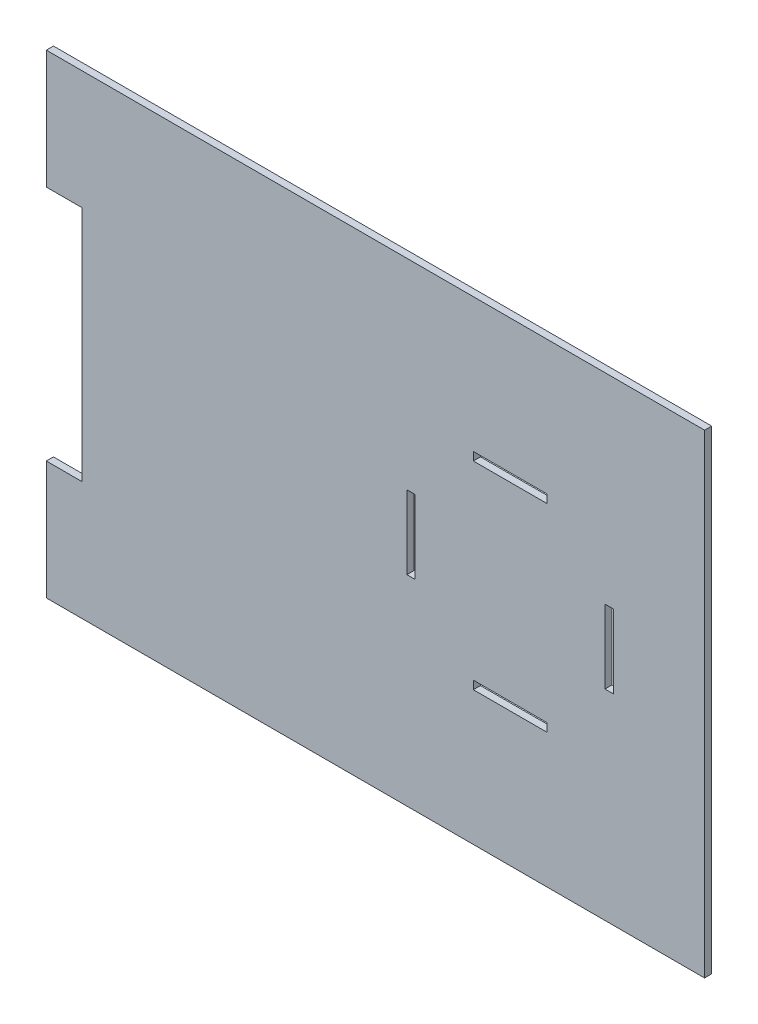
from build123d import *

# Parameters (mm, degrees)
ESBO_O1_W                = 555
ESBO_O1_H                = 200
RESSALTO_EXTRUS_O1_DEPTH = 3
ESBO_O2_W                = 3.5
ESBO_O2_H                = 31
ESBO_O2_W_2              = 31
ESBO_O2_H_2              = 3.5
CORTE_EXTRUS_O1_DEPTH    = 295.983474113
ESBO_O3_OUTSIDE_W        = 674.988
ESBO_O3_OUTSIDE_H        = 319.988
CORTE_EXTRUS_O3_DEPTH    = 295.983474113


with BuildPart() as part:
    # Esboço1 → Ressalto-extrusão1 (new body)
    with BuildSketch(Plane.XY):
        Rectangle(ESBO_O1_W, ESBO_O1_H)
    extrude(amount=RESSALTO_EXTRUS_O1_DEPTH)

    # Esboço2 → Corte-extrusão1 (cut, through all)
    with BuildSketch(Plane.XY.offset(3)):
        with Locations((237.25, 0)):
            Rectangle(ESBO_O2_W, ESBO_O2_H)
        with Locations((-153.75, 0)):
            Rectangle(ESBO_O2_W, ESBO_O2_H)
        with Locations((-237.25, 0)):
            Rectangle(ESBO_O2_W, ESBO_O2_H)
        with Locations((-195.5, 41.75)):
            Rectangle(ESBO_O2_W_2, ESBO_O2_H_2)
        with Locations((-195.5, -41.75)):
            Rectangle(ESBO_O2_W_2, ESBO_O2_H_2)
        with Locations((153.75, 0)):
            Rectangle(ESBO_O2_W, ESBO_O2_H)
        with Locations((195.5, -41.75)):
            Rectangle(ESBO_O2_W_2, ESBO_O2_H_2)
        with Locations((195.5, 41.75)):
            Rectangle(ESBO_O2_W_2, ESBO_O2_H_2)
    extrude(amount=-CORTE_EXTRUS_O1_DEPTH, mode=Mode.SUBTRACT)

    # Esboço3 outside → Corte-extrusão3 (cut, through all)
    with BuildSketch(Plane.XY.offset(3)):
        Rectangle(ESBO_O3_OUTSIDE_W, ESBO_O3_OUTSIDE_H)
        Polygon((0, 100), (0, 50), (15, 50), (15, -50), (0, -50), (0, -100), (277.5, -100), (277.5, 100), align=None, mode=Mode.SUBTRACT)
    extrude(amount=-CORTE_EXTRUS_O3_DEPTH, mode=Mode.SUBTRACT)


solid = part.part
